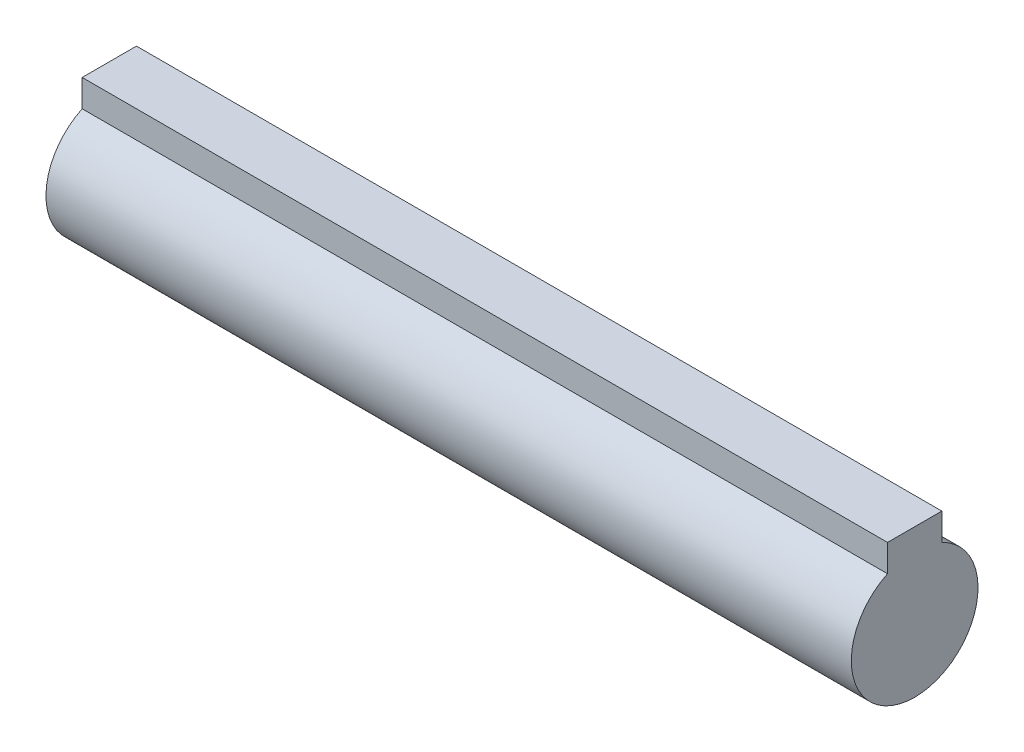
from build123d import *
from build123d.topology import SkipClean

# Parameters (mm, degrees)
BOSS_EXTRU_1_DEPTH           = 50
ENL_V_START                  = -6
ENL_V_MAT_EXTRU_1_DEPTH      = 6
ESQUISSE5_R                  = 3.5
BOSS_EXTRU_2_DEPTH           = 10
ENL_V_MAT_EXTRU_2_DEPTH      = 10
ENL_V_MAT_EXTRU_2_DEPTH_BACK = 10
ESQUISSE6_W                  = 18.121424082
ESQUISSE6_H                  = 16.818170981
BOSS_EXTRU_3_DEPTH           = 16


with BuildPart() as part:
    # Esquisse1 → Boss.-Extru.1 (new body)
    with BuildSketch(Plane(origin=(0, 0, 0), x_dir=(0, 0, -1), z_dir=(1, 0, 0))):
        with BuildLine():
            ThreePointArc((1.5, 3.16227766), (0, 3.5), (-1.5, 3.16227766))
            Line((-1.5, 3.16227766), (1.5, 3.16227766))
        make_face()
        with BuildLine():
            Line((1.5, 3.16227766), (-1.5, 3.16227766))
            ThreePointArc((-1.5, 3.16227766), (-1.870828693, -2.958039892), (3.5, 0))
            ThreePointArc((3.5, 0), (2.958039892, 1.870828693), (1.5, 3.16227766))
        make_face()
        with BuildLine():
            Line((-1.5, 4.66227766), (-1.5, 3.16227766))
            ThreePointArc((-1.5, 3.16227766), (0, 3.5), (1.5, 3.16227766))
            Line((1.5, 3.16227766), (1.5, 4.66227766))
            Line((1.5, 4.66227766), (-1.5, 4.66227766))
        make_face()
    extrude(amount=BOSS_EXTRU_1_DEPTH)

    # Esquisse4 → Enlèv. mat.-Extru.1 (cut)
    with BuildSketch(Plane(origin=(50, 0, 0), x_dir=(0, 0, -1), z_dir=(1, 0, 0)).offset(ENL_V_START)):
        with BuildLine():
            Line((-1.5, 3.16227766), (-1.5, 4.66227766))
            Line((-1.5, 4.66227766), (1.5, 4.66227766))
            Line((1.5, 4.66227766), (1.5, 3.16227766))
            ThreePointArc((1.5, 3.16227766), (0, 3.5), (-1.5, 3.16227766))
        make_face()
    enl_v_mat_extru_1 = extrude(amount=ENL_V_MAT_EXTRU_1_DEPTH, mode=Mode.SUBTRACT)

    # Symétrie1: Enlèv. mat.-Extru.1 across plane
    with SkipClean():  # the faces are left unmerged after this step: merging them gives an invalid solid
        add(enl_v_mat_extru_1.mirror(Plane(origin=(25, 0, 0), x_dir=(0, 0, 1), z_dir=(1, 0, 0))), mode=Mode.SUBTRACT)

    # Esquisse5 → Boss.-Extru.2 (add)
    with SkipClean():  # the faces are left unmerged after this step: merging them gives an invalid solid
        with BuildSketch(Plane.ZY):
            Circle(ESQUISSE5_R)
        extrude(amount=BOSS_EXTRU_2_DEPTH)

    # Esquisse6 → Enlèv. mat.-Extru.2 (cut, two sides: drawn at the far end of the back side and taken through both)
    with SkipClean():  # the faces are left unmerged after this step: merging them gives an invalid solid
        with BuildSketch(Plane.XY.offset(-ENL_V_MAT_EXTRU_2_DEPTH_BACK)):
            with Locations((43.560712041, -0.183428049)):
                Rectangle(ESQUISSE6_W, ESQUISSE6_H)
        extrude(amount=ENL_V_MAT_EXTRU_2_DEPTH + ENL_V_MAT_EXTRU_2_DEPTH_BACK, mode=Mode.SUBTRACT)

    # Esquisse8 → Boss.-Extru.3 (add)
    with BuildSketch(Plane.ZY.offset(-6)):
        with BuildLine():
            Line((1.5, 3.16227766), (1.5, 4.66227766))
            Line((1.5, 4.66227766), (-1.5, 4.66227766))
            Line((-1.5, 4.66227766), (-1.5, 3.16227766))
            ThreePointArc((-1.5, 3.16227766), (0, 3.5), (1.5, 3.16227766))
        make_face()
    extrude(amount=BOSS_EXTRU_3_DEPTH)


solid = part.part
